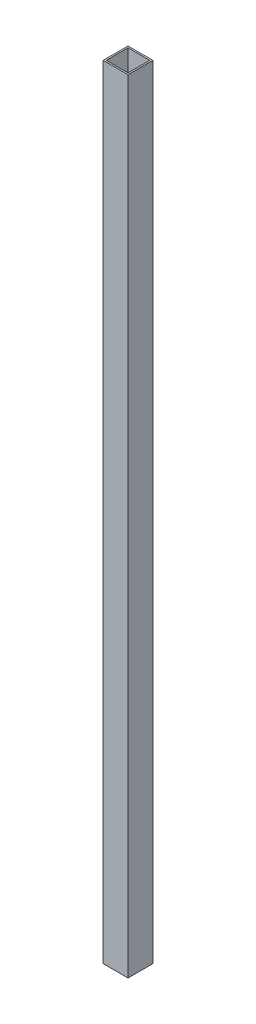
from build123d import *

# Parameters (mm, degrees)
SKETCH1_W           = 25.4
SKETCH1_H           = 25.4
SKETCH1_W_2         = 22.225
SKETCH1_H_2         = 22.225
BOSS_EXTRUDE2_DEPTH = 800.1


with BuildPart() as part:
    # Sketch1 → Boss-Extrude2 (new body)
    with BuildSketch(Plane(origin=(0, 0, 0), x_dir=(1, 0, 0), z_dir=(0, 1, 0))):
        Rectangle(SKETCH1_W, SKETCH1_H)
        Rectangle(SKETCH1_W_2, SKETCH1_H_2, mode=Mode.SUBTRACT)
    extrude(amount=BOSS_EXTRUDE2_DEPTH)


solid = part.part
